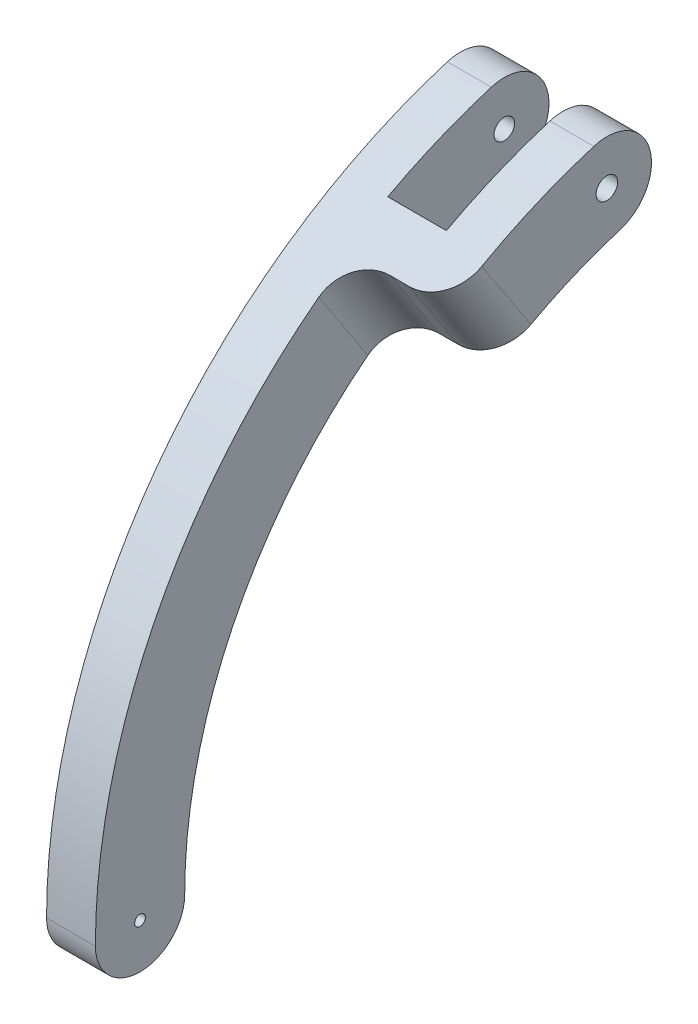
from build123d import *

# Parameters (mm, degrees)
ESQUISSE1_R                  = 0.550000000000003
ESQUISSE1_R_2                = 1.050000000000001
BOSS_EXTRU_1_DEPTH           = 5
BOSS_EXTRU_2_DEPTH           = 10
ENL_V_MAT_EXTRU_1_DEPTH      = 61.96067460568836
ENL_V_MAT_EXTRU_1_DEPTH_BACK = 61.96067460568836
CONG_1_R                     = 4
ESQUISSE4_R                  = 1.100000000000346
ENL_V_MAT_EXTRU_2_DEPTH      = 81.96368978508603


with BuildPart() as part:
    # Esquisse1 → Boss.-Extru.1 (new body)
    with BuildSketch(Plane(origin=(0, 0, 0), x_dir=(0, 0, -1), z_dir=(1, 0, 0))):
        with BuildLine():
            ThreePointArc((-48.767999999999994, 0), (-39.18749628154784, 29.028571428571436), (-14.210176870748295, 46.65178128755695))
            ThreePointArc((-14.210176870748295, 46.65178128755695), (-11.168776456672475, 52.35758986489808), (-16.874585034013602, 55.39899027897389))
            ThreePointArc((-16.874585034013602, 55.39899027897389), (-46.53515183433805, 34.47142857142858), (-57.91199999999999, 0))
            ThreePointArc((-57.91199999999999, 0), (-53.339999999999996, -4.571999999999996), (-48.767999999999994, 0))
        make_face()
        with Locations((-53.339999999999996, 0)):
            Circle(ESQUISSE1_R, mode=Mode.SUBTRACT)
        with Locations((-15.542380952380952, 51.02538578326543)):
            Circle(ESQUISSE1_R_2, mode=Mode.SUBTRACT)
    extrude(amount=BOSS_EXTRU_1_DEPTH)

    # Esquisse2 → Boss.-Extru.2 (add)
    with BuildSketch(Plane(origin=(5, 0, 0), x_dir=(0, 0, -1), z_dir=(1, 0, 0))):
        with BuildLine():
            Line((-31.772627007894677, 48.41797101301542), (-26.755896427700776, 40.77302822148666))
            ThreePointArc((-26.755896427700776, 40.77302822148666), (-20.692866519079303, 44.16019813388031), (-14.210176870748292, 46.65178128755695))
            ThreePointArc((-14.210176870748292, 46.65178128755695), (-11.168776456672475, 52.35758986489808), (-16.874585034013602, 55.3989902789739))
            ThreePointArc((-16.874585034013602, 55.3989902789739), (-24.57277899140668, 52.44023528398287), (-31.772627007894677, 48.41797101301542))
        make_face()
    extrude(amount=BOSS_EXTRU_2_DEPTH)

    # Esquisse3 → Enlèv. mat.-Extru.1 (cut, two sides: drawn at the far end of the back side and taken through both)
    with BuildSketch(Plane(origin=(-2.205e-14, 48.41797101301542, 31.77262700789469), x_dir=(-1, 0, -6.9e-16), z_dir=(0, 0.836061110184684, 0.5486363276677492)).offset(-ENL_V_MAT_EXTRU_1_DEPTH_BACK)):
        Polygon((-4.500000000000018, -21.069257970907522), (-10.500000000000023, -21.069257970907522), (-10.500000000000023, -5.000000000000025), (-4.500000000000011, -5.0000000000000195), align=None)
    extrude(amount=ENL_V_MAT_EXTRU_1_DEPTH + ENL_V_MAT_EXTRU_1_DEPTH_BACK, mode=Mode.SUBTRACT)

    # Congé1
    cong_1_edges = [part.edges().sort_by_distance(p)[0] for p in [
        (5, 44.595499617251036, 29.264261717797726),
        (15, 44.595499617251036, 29.264261717797726),
    ]]
    fillet(cong_1_edges, radius=CONG_1_R)

    # Esquisse4 → Enlèv. mat.-Extru.2 (cut, through all)
    with BuildSketch(Plane.ZY.offset(-10.500000000000023)):
        with Locations((15.542380952379233, 51.025385783272924)):
            Circle(ESQUISSE4_R)
    extrude(amount=-ENL_V_MAT_EXTRU_2_DEPTH, mode=Mode.SUBTRACT)


solid = part.part
